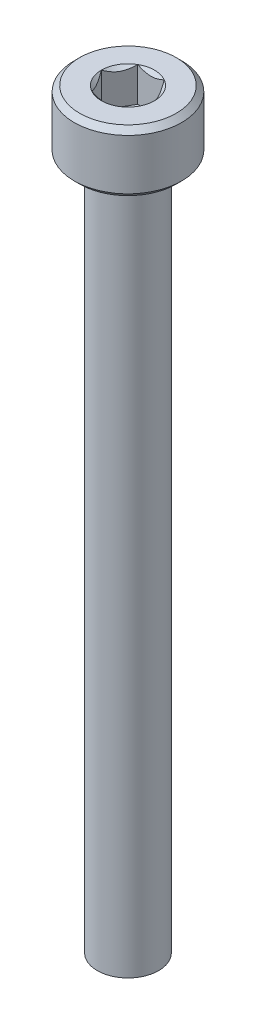
from build123d import *

# Parameters (mm, degrees)
SKETCH1_R           = 3.5
BOSS_EXTRUDE1_DEPTH = 4
CUT_EXTRUDE1_DEPTH  = 2.25
CHAMFER1_SIZE       = 0.35
SKETCH_1_R          = 2
EXTRUDE_1_DEPTH     = 45


with BuildPart() as part:
    # Sketch1 → Boss-Extrude1 (new body)
    with BuildSketch(Plane(origin=(0, 0, 0), x_dir=(1, 0, 0), z_dir=(0, 1, 0))):
        with Locations(Location((0, 0, 0), (0, 0, 270))):
            Circle(SKETCH1_R)
    extrude(amount=BOSS_EXTRUDE1_DEPTH)

    # Sketch2 → Cut-Extrude1 (cut)
    with BuildSketch(Plane(origin=(0, 4, 0), x_dir=(1, 0, 0), z_dir=(0, 1, 0))):
        Polygon((0.866025404, 1.5), (-0.866025404, 1.5), (-1.732050808, 0), (-0.866025404, -1.5), (0.866025404, -1.5), (1.732050808, 0), align=None)
    extrude(amount=-CUT_EXTRUDE1_DEPTH, mode=Mode.SUBTRACT)

    # Cut-Extrude2 cone 1 section (through the dimple's axis) → Cut-Extrude2 (revolve, cut)
    with BuildSketch(Plane(origin=(0, 4, 0), x_dir=(0, 0, 1), z_dir=(1, 0, 0))):
        Polygon((0, 0), (1.732050808, 0), (0, 1.732050808), align=None)
    revolve(axis=Axis((0, 4, 0), (0, -1, 0)), mode=Mode.SUBTRACT)

    # Chamfer1
    chamfer1_edges = [part.edges().sort_by_distance(p)[0] for p in [
        (0, 0, -3.5),
        (0, 4, -3.5),
    ]]
    chamfer(chamfer1_edges, length=CHAMFER1_SIZE)

    # 草图1 → 凸台-拉伸1 (add)
    with BuildSketch(Plane(origin=(0, 0, 0), x_dir=(-1, 0, 0), z_dir=(0, -1, 0))):
        with Locations(Location((0, 0, 0), (0, 0, 270))):
            Circle(SKETCH_1_R)
    extrude(amount=EXTRUDE_1_DEPTH)


solid = part.part
